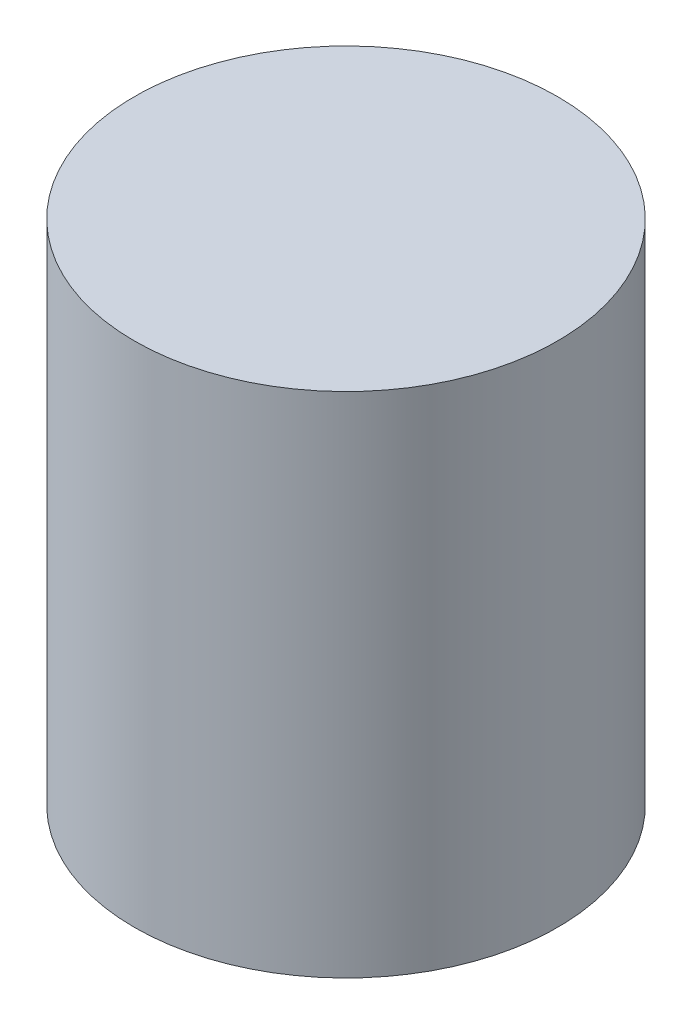
from build123d import *

# Parameters (mm, degrees)
SKETCH_1_R          = 25
EXTRUDE_1_DEPTH     = 60
SKETCH_2_R          = 22
CUT_EXTRUDE_1_DEPTH = 55
SKETCH_3_R          = 22
SKETCH_3_R_2        = 15
EXTRUDE_2_DEPTH     = 3


with BuildPart() as part:
    # 草图1 → 凸台-拉伸1 (new body)
    with BuildSketch(Plane(origin=(0, 0, 0), x_dir=(1, 0, 0), z_dir=(0, 1, 0))):
        with Locations(Location((0, 0, 0), (0, 0, 270))):
            Circle(SKETCH_1_R)
    extrude(amount=EXTRUDE_1_DEPTH)

    # 草图2 → 切除-拉伸1 (cut)
    with BuildSketch(Plane.XZ):
        with Locations(Location((0, 0, 0), (0, 0, 270))):
            Circle(SKETCH_2_R)
    extrude(amount=-CUT_EXTRUDE_1_DEPTH, mode=Mode.SUBTRACT)

    # 草图3 → 凸台-拉伸2 (add)
    with BuildSketch(Plane.XZ):
        with Locations(Location((0, 0, 0), (0, 0, 270))):
            Circle(SKETCH_3_R)
        with Locations(Location((0, 0, 0), (0, 0, 270))):
            Circle(SKETCH_3_R_2, mode=Mode.SUBTRACT)
    extrude(amount=-EXTRUDE_2_DEPTH)


solid = part.part
